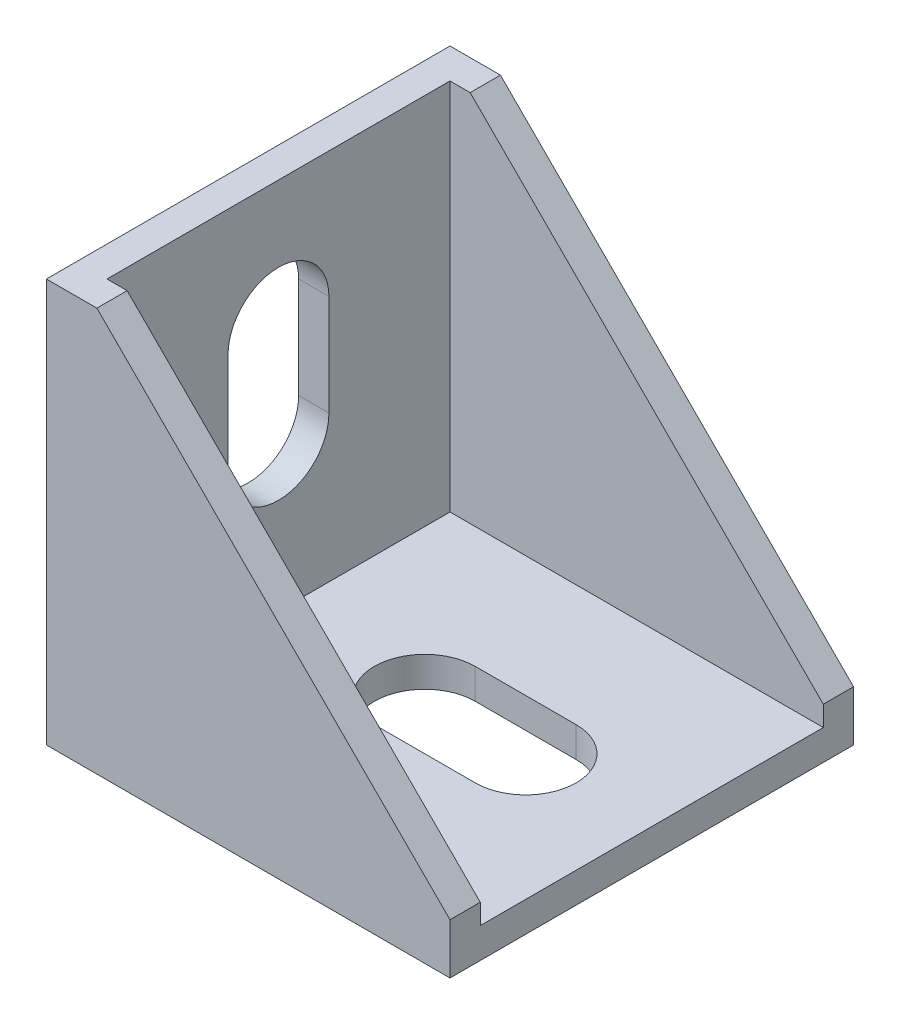
from build123d import *

# Parameters (mm, degrees)
BOSS_EXTRUDE1_DEPTH = 20
SHELL1_T            = -3
CUT_EXTRUDE1_DEPTH  = 40


with BuildPart() as part:
    # Sketch1 → Boss-Extrude1 (new, symmetric)
    with BuildSketch(Plane.XY):
        Polygon((40, 0), (0, 0), (0, 40), (5, 40), (40, 5), align=None)
    extrude(amount=BOSS_EXTRUDE1_DEPTH, both=True)

    # Shell1
    shell1_openings = [part.faces().sort_by_distance(p)[0] for p in [
        (22.5, 22.5, 0),
        (40, 2.5, 0),
        (2.5, 40, 0),
    ]]
    offset(amount=SHELL1_T, openings=shell1_openings, kind=Kind.INTERSECTION)

    # Sketch2 → Cut-Extrude1 (cut)
    with BuildSketch(Plane(origin=(3, 0, 0), x_dir=(0, 0, -1), z_dir=(1, 0, 0))):
        with BuildLine():
            Line((5, 27.5), (5, 17.5))
            ThreePointArc((5, 17.5), (0, 12.5), (-5, 17.5))
            Line((-5, 17.5), (-5, 27.5))
            ThreePointArc((-5, 27.5), (0, 32.5), (5, 27.5))
        make_face()
    cut_extrude1 = extrude(amount=-CUT_EXTRUDE1_DEPTH, mode=Mode.SUBTRACT)

    # Mirror1: Cut-Extrude1 across plane
    add(cut_extrude1.mirror(Plane(origin=(0, 0, 0), x_dir=(0, 0, 1), z_dir=(0.7071067811865476, -0.7071067811865476, 0))), mode=Mode.SUBTRACT)


solid = part.part
